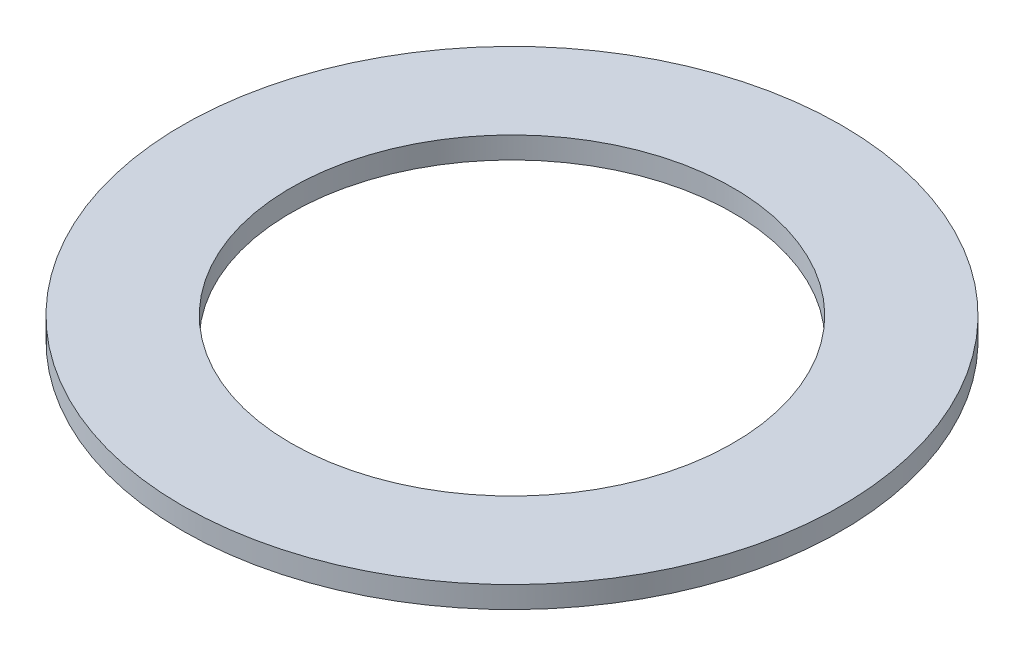
from build123d import *

# Parameters (mm, degrees)
SKETCH1_R           = 7.6
SKETCH1_R_2         = 5.1
BOSS_EXTRUDE1_DEPTH = 0.5


with BuildPart() as part:
    # Sketch1 → Boss-Extrude1 (new body)
    with BuildSketch(Plane(origin=(0, 0, 0), x_dir=(1, 0, 0), z_dir=(0, 1, 0))):
        with Locations(Location((0, 0, 0), (0, 0, 270))):
            Circle(SKETCH1_R)
        with Locations(Location((0, 0, 0), (0, 0, 270))):
            Circle(SKETCH1_R_2, mode=Mode.SUBTRACT)
    extrude(amount=BOSS_EXTRUDE1_DEPTH)


solid = part.part
